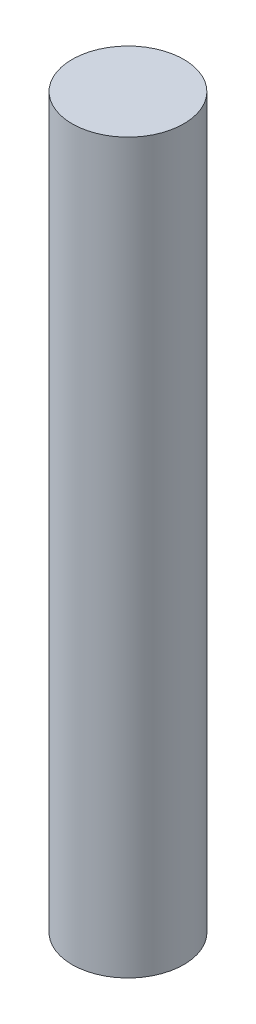
from build123d import *

# Parameters (mm, degrees)
SKETCH1_R           = 1.15
BOSS_EXTRUDE1_DEPTH = 15


with BuildPart() as part:
    # Sketch1 → Boss-Extrude1 (new body)
    with BuildSketch(Plane(origin=(0, 0, 0), x_dir=(1, 0, 0), z_dir=(0, 1, 0))):
        with Locations(Location((0, 0, 0), (0, 0, 270))):
            Circle(SKETCH1_R)
    extrude(amount=BOSS_EXTRUDE1_DEPTH)


solid = part.part
